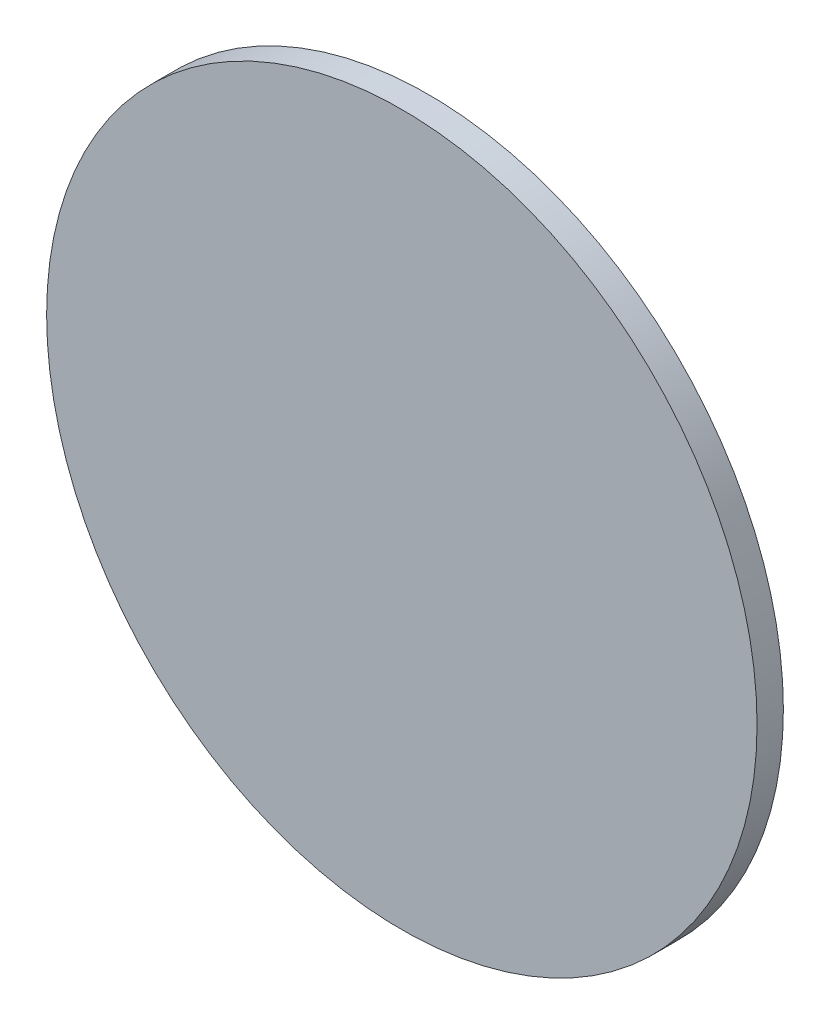
from build123d import *

# Parameters (mm, degrees)
CROQUIS1_R              = 67.5
SALIENTE_EXTRUIR1_DEPTH = 5


with BuildPart() as part:
    # Croquis1 → Saliente-Extruir1 (new body)
    with BuildSketch(Plane.XY):
        Circle(CROQUIS1_R)
    extrude(amount=SALIENTE_EXTRUIR1_DEPTH)


solid = part.part
